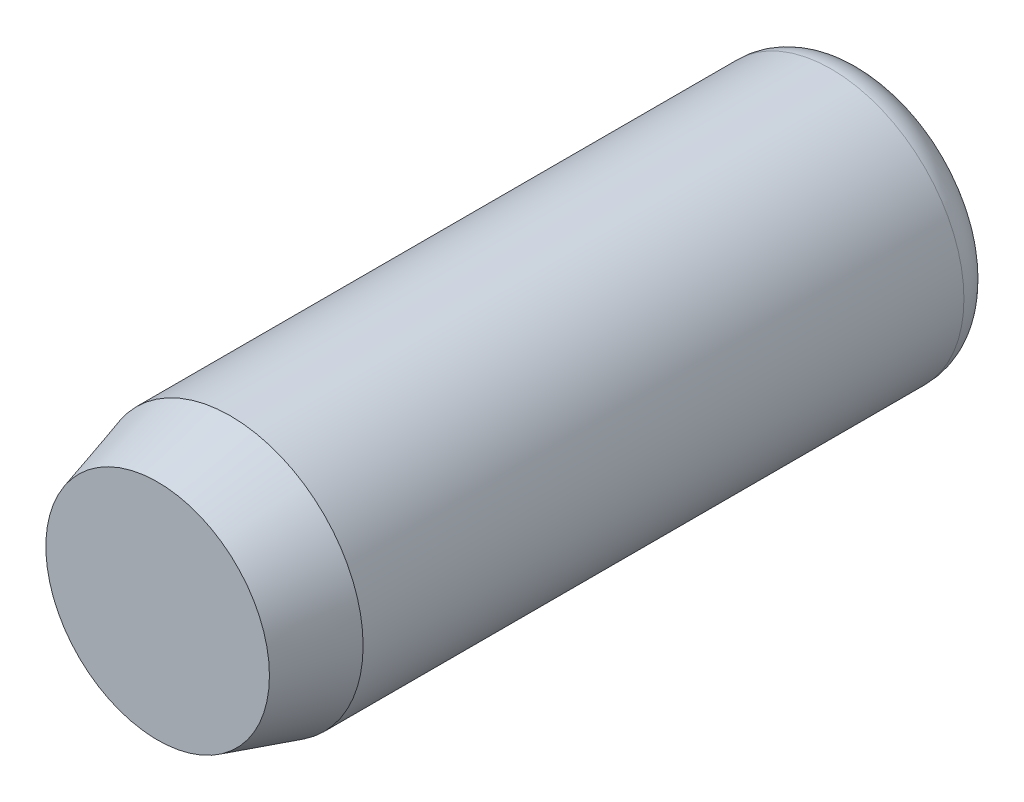
from build123d import *


with BuildPart() as part:
    # Sketch3 → Revolve1 (revolve)
    with BuildSketch(Plane(origin=(0, 0, 0), x_dir=(0, 0, -1), z_dir=(1, 0, 0)), mode=Mode.PRIVATE) as revolve1_sk:
        with BuildLine():
            Line((3.175, 0.885825), (3.175, 0))
            Line((3.175, 0), (-3.175, 0))
            Line((-3.175, 0), (-3.175, 1.0033))
            Line((-3.175, 1.0033), (-2.521720089, 1.190625))
            Line((-2.521720089, 1.190625), (2.8702, 1.190625))
            ThreePointArc((2.8702, 1.190625), (3.085726147, 1.101351147), (3.175, 0.885825))
        make_face()
    revolve(revolve1_sk.sketch.rotate(Axis((0, 0, 3.175), (0, 0, -1)), 90), axis=Axis((0, 0, 3.175), (0, 0, -1)))


solid = part.part
